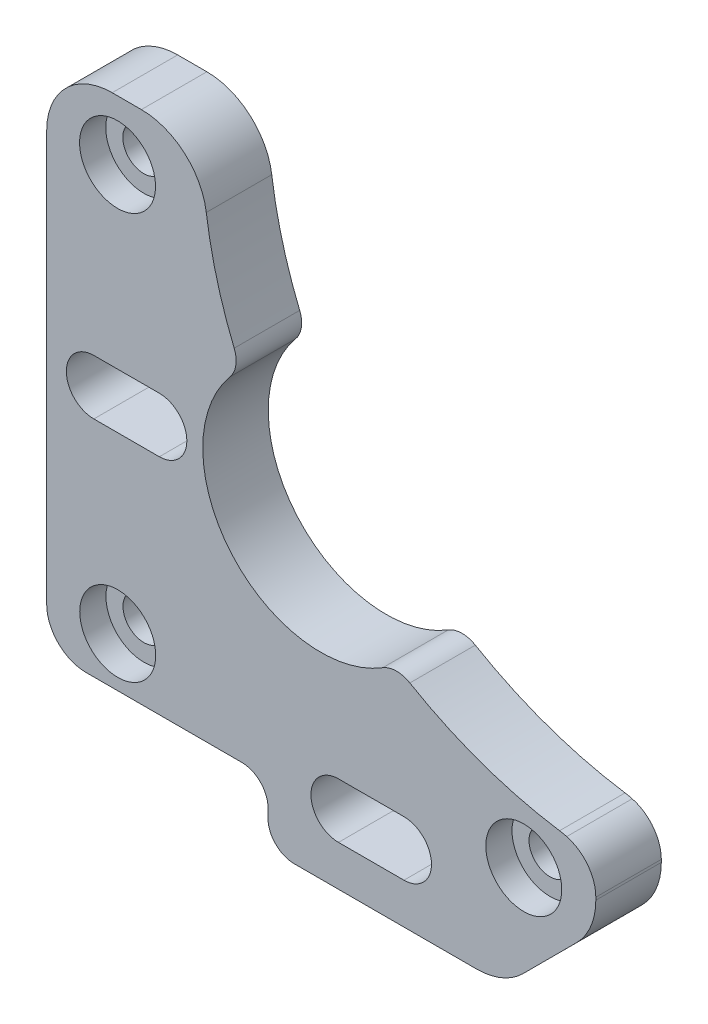
from build123d import *

# Parameters (mm, degrees)
SKETCH_1_R          = 1.6
EXTRUDE_1_DEPTH     = 5
SKETCH_2_R          = 2.9
CUT_EXTRUDE_1_DEPTH = 2
CUT_EXTRUDE_3_DEPTH = 71.600960604
FILLET_1_R          = 5
FILLET_2_R          = 3
FILLET_4_R          = 2
FILLET_6_R          = 2
FILLET_7_R          = 2
FILLET_8_R          = 3


with BuildPart() as part:
    # 草图1 → 凸台-拉伸1 (new body)
    with BuildSketch(Plane.XY):
        with BuildLine():
            Line((-41.565100182, -49.426292213), (-39.485969284, -49.426292213))
            Line((-39.485969284, -49.426292213), (-13.65407564, -49.426292213))
            Line((-13.65407564, -49.426292213), (-11.764178943, -49.426292213))
            ThreePointArc((-11.764178943, -49.426292213), (-8.228645037, -47.961826119), (-6.764178943, -44.426292213))
            Line((-6.764178943, -44.426292213), (-6.764178943, -42.471801942))
            Line((-6.764178943, -42.471801942), (-6.761688654, -42.088770435))
            ThreePointArc((-6.761688654, -42.088770435), (-7.959392434, -38.809211433), (-11.011044569, -37.112915219))
            ThreePointArc((-11.011044569, -37.112915219), (-17.52195854, -35.410370983), (-23.534396799, -32.386921995))
            ThreePointArc((-23.534396799, -32.386921995), (-36.041802291, -31.338005667), (-35.33797784, -18.806443564))
            ThreePointArc((-35.33797784, -18.806443564), (-36.996722237, -14.362622261), (-37.982061376, -9.722785245))
            ThreePointArc((-37.982061376, -9.722785245), (-39.647864751, -6.630640555), (-42.936394307, -5.397014589))
            Line((-42.936394307, -5.397014589), (-45.165100182, -5.397014589))
            ThreePointArc((-45.165100182, -5.397014589), (-48.700634088, -6.861480683), (-50.165100182, -10.397014589))
            Line((-50.165100182, -10.397014589), (-50.165100182, -15.397014589))
            Line((-50.165100182, -15.397014589), (-50.165100182, -25.564927735))
            Line((-50.165100182, -25.564927735), (-50.165100182, -38.747161315))
            Line((-50.165100182, -38.747161315), (-50.165100182, -41.426292213))
            Line((-50.165100182, -41.426292213), (-50.165100182, -46.426292213))
            Line((-50.165100182, -46.426292213), (-45.165100182, -46.426292213))
            Line((-45.165100182, -46.426292213), (-41.565100182, -46.426292213))
            Line((-41.565100182, -46.426292213), (-41.565100182, -49.426292213))
        make_face()
        with Locations((-44.74192859, -40.941023834)):
            Circle(SKETCH_1_R, mode=Mode.SUBTRACT)
        with BuildLine():
            ThreePointArc((-27.889312547, -46.323727421), (-29.989312547, -44.223727421), (-27.889312547, -42.123727421))
            Line((-27.889312547, -42.123727421), (-22.889312547, -42.123727421))
            ThreePointArc((-22.889312547, -42.123727421), (-20.789312547, -44.223727421), (-22.889312547, -46.323727421))
            Line((-22.889312547, -46.323727421), (-27.889312547, -46.323727421))
        make_face(mode=Mode.SUBTRACT)
        with Locations((-13.741931799, -40.926918244)):
            Circle(SKETCH_1_R, mode=Mode.SUBTRACT)
        with BuildLine():
            ThreePointArc((-46.565100182, -27.664927735), (-48.665100182, -25.564927735), (-46.565100182, -23.464927735))
            Line((-46.565100182, -23.464927735), (-41.565100182, -23.464927735))
            ThreePointArc((-41.565100182, -23.464927735), (-39.465100182, -25.564927735), (-41.565100182, -27.664927735))
            Line((-41.565100182, -27.664927735), (-46.565100182, -27.664927735))
        make_face(mode=Mode.SUBTRACT)
        with Locations((-44.756034179, -9.941027044)):
            Circle(SKETCH_1_R, mode=Mode.SUBTRACT)
    extrude(amount=EXTRUDE_1_DEPTH)

    # 草图2 → 切除-拉伸1 (cut)
    with BuildSketch(Plane(origin=(0, 0, 5), x_dir=(-1, 0, 0), z_dir=(0, 0, -1))):
        with Locations((44.756034179, -9.941027044)):
            Circle(SKETCH_2_R)
        with Locations((44.74192859, -40.941023834)):
            Circle(SKETCH_2_R)
        with Locations((13.741931799, -40.926918244)):
            Circle(SKETCH_2_R)
    extrude(amount=CUT_EXTRUDE_1_DEPTH, mode=Mode.SUBTRACT)

    # 草图3 → 切除-拉伸3 (cut, through all)
    with BuildSketch(Plane(origin=(0, 0, 0), x_dir=(-1, 0, 0), z_dir=(0, 0, -1))):
        Polygon((8.241263234, -42.394978236), (12.268866598, -46.426248541), (15.268866287, -49.426292213), (33.268866287, -49.426292213), (33.268866287, -44.726292213), (48.610476999, -44.726292213), (50.241258886, -44.726292213), (50.241258886, -51.356689398), (5.002855071, -51.356689398), (5.002855071, -38.135185544), (8.243201521, -38.135185544), align=None)
    extrude(amount=-CUT_EXTRUDE_3_DEPTH, mode=Mode.SUBTRACT)

    # 圆角1
    fillet_1_edges = [part.edges().sort_by_distance(p)[0] for p in [
        (-8.241263234, -42.394978236, 2.5),
        (-15.268866287, -49.426292213, 2.5),
    ]]
    fillet(fillet_1_edges, radius=FILLET_1_R)

    # 圆角2
    fillet_2_edges = [part.edges().sort_by_distance(p)[0] for p in [
        (-8.243033782, -38.503826079, 2.5),
    ]]
    fillet(fillet_2_edges, radius=FILLET_2_R)

    # 圆角4
    fillet_4_edges = [part.edges().sort_by_distance(p)[0] for p in [
        (-33.268866287, -49.426292213, 2.5),
    ]]
    fillet(fillet_4_edges, radius=FILLET_4_R)

    # 圆角6
    fillet_6_edges = [part.edges().sort_by_distance(p)[0] for p in [
        (-33.268866287, -44.726292213, 2.5),
    ]]
    fillet(fillet_6_edges, radius=FILLET_6_R)

    # 圆角7
    fillet_7_edges = [part.edges().sort_by_distance(p)[0] for p in [
        (-23.534396799, -32.386921995, 2.5),
        (-35.33797784, -18.806443564, 2.5),
    ]]
    fillet(fillet_7_edges, radius=FILLET_7_R)

    # 圆角8
    fillet_8_edges = [part.edges().sort_by_distance(p)[0] for p in [
        (-50.165100182, -44.726292213, 2.5),
    ]]
    fillet(fillet_8_edges, radius=FILLET_8_R)


solid = part.part
